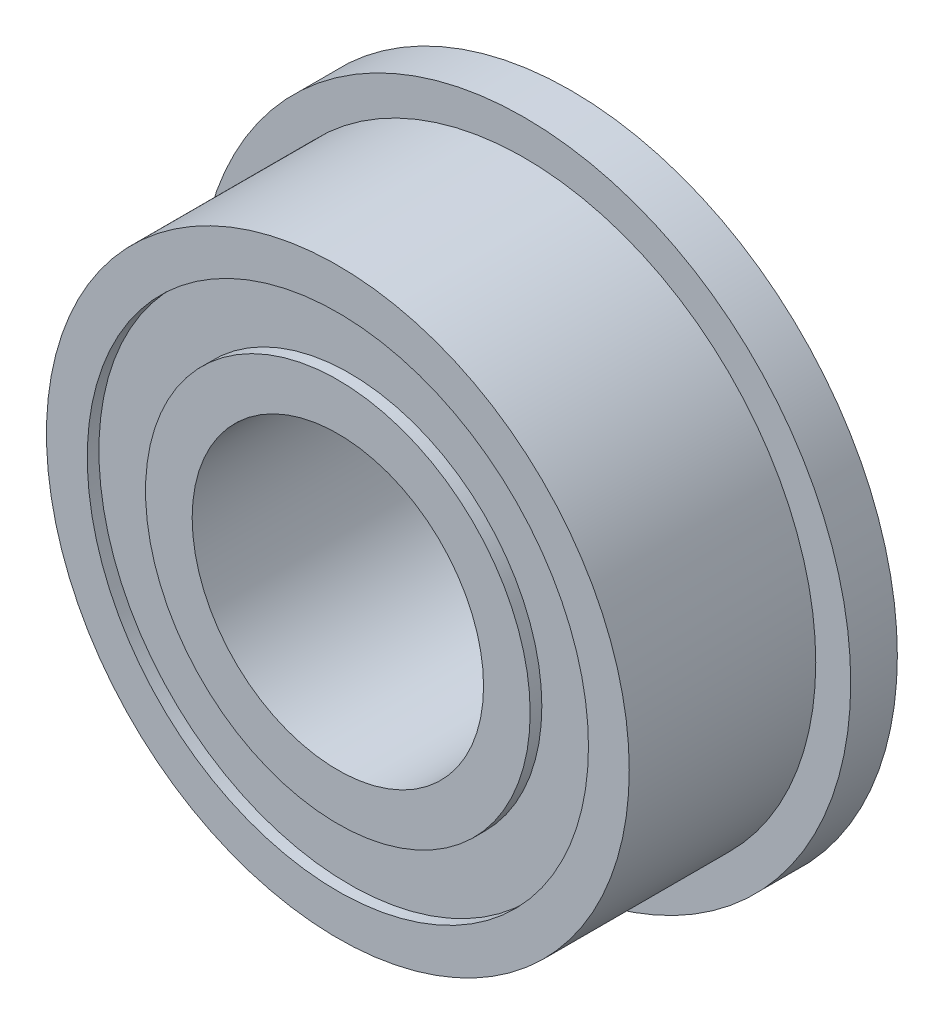
from build123d import *

# Parameters (mm, degrees)
SKETCH1_R        = 5.6
SKETCH1_R_2      = 3.3
FLANGE_DEPTH     = 0.8
SKETCH2_R        = 5
SKETCH2_R_2      = 4.3
OUTER_RING_DEPTH = 3.2
SKETCH3_R        = 3.3
SKETCH3_R_2      = 2.5
INNER_RING_DEPTH = 4
SKETCH4_R        = 4.3
SKETCH4_R_2      = 3.3
SHIELDS_DEPTH    = 2.8


with BuildPart() as part:
    # Sketch1 → Flange (new body)
    with BuildSketch(Plane.XY):
        Circle(SKETCH1_R)
        Circle(SKETCH1_R_2, mode=Mode.SUBTRACT)
    extrude(amount=FLANGE_DEPTH)

    # Sketch2 → Outer_ring (add)
    with BuildSketch(Plane.XY.offset(0.8)):
        Circle(SKETCH2_R)
        Circle(SKETCH2_R_2, mode=Mode.SUBTRACT)
    extrude(amount=OUTER_RING_DEPTH)

    # Sketch3 → Inner_ring (add)
    with BuildSketch(Plane.XY):
        Circle(SKETCH3_R)
        Circle(SKETCH3_R_2, mode=Mode.SUBTRACT)
    extrude(amount=INNER_RING_DEPTH)

    # Sketch4 → Shields (add)
    with BuildSketch(Plane.XY.offset(1)):
        Circle(SKETCH4_R)
        Circle(SKETCH4_R_2, mode=Mode.SUBTRACT)
    extrude(amount=SHIELDS_DEPTH)


solid = part.part
